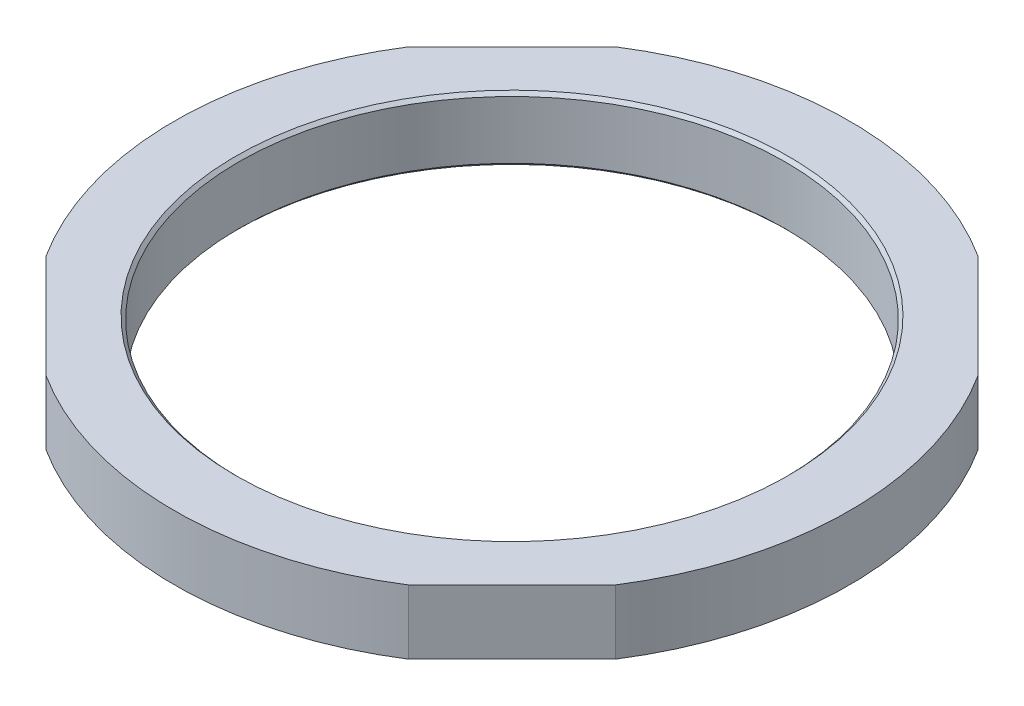
from build123d import *

# Parameters (mm, degrees)
BASES_R            = 21
BASES_R_2          = 17
BASE_DEPTH         = 2
FLATCUT_DEPTH      = 30.765752132
FCCIRPATTERN_COUNT = 4
BASECHAMFER_SIZE   = 0.2


with BuildPart() as part:
    # BaseS → Base (new, symmetric)
    with BuildSketch(Plane(origin=(0, 0, 0), x_dir=(1, 0, 0), z_dir=(0, 1, 0))):
        Circle(BASES_R)
        Circle(BASES_R_2, mode=Mode.SUBTRACT)
    extrude(amount=BASE_DEPTH, both=True)

    # FlatCutS → FlatCut (cut, symmetric)
    with BuildSketch(Plane(origin=(0, 0, 0), x_dir=(1, 0, 0), z_dir=(0, 1, 0))):
        with BuildLine():
            Line((11.274664333, 17.716713696), (17.716713696, 11.274664333))
            ThreePointArc((17.716713696, 11.274664333), (14.849242405, 14.849242405), (11.274664333, 17.716713696))
        make_face()
    flatcut = extrude(amount=FLATCUT_DEPTH, both=True, mode=Mode.SUBTRACT)

    # FCCirPattern: FlatCut ×4 about axis
    fccirpattern_axis = Axis((0, 1.1, 0), (0, -1, 0))
    for i in range(1, FCCIRPATTERN_COUNT):
        add(flatcut.rotate(fccirpattern_axis, i * 360 / FCCIRPATTERN_COUNT), mode=Mode.SUBTRACT)

    # BaseChamfer
    basechamfer_edges = [part.edges().sort_by_distance(p)[0] for p in [
        (-17, -2, 0),
        (-17, 2, 0),
    ]]
    chamfer(basechamfer_edges, length=BASECHAMFER_SIZE)


solid = part.part
